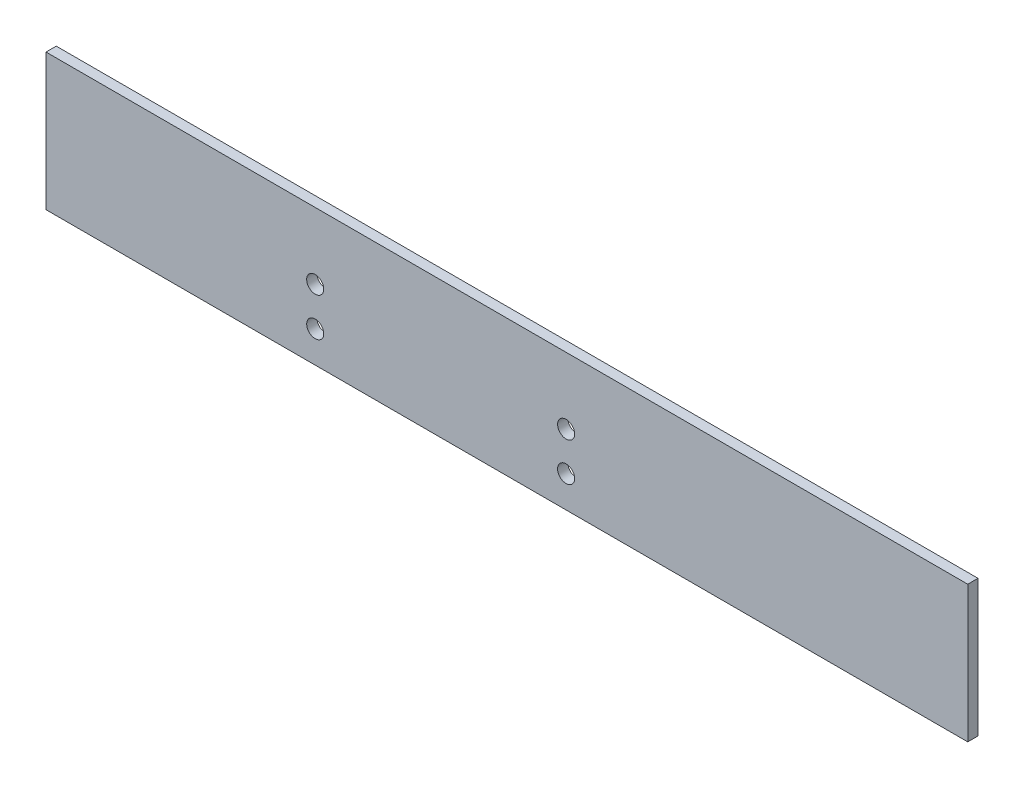
from build123d import *

# Parameters (mm, degrees)
ESQUISSE1_W        = 270
ESQUISSE1_H        = 40
ESQUISSE1_R        = 2.5
BOSS_EXTRU_1_DEPTH = 3


with BuildPart() as part:
    # Esquisse1 → Boss.-Extru.1 (new body)
    with BuildSketch(Plane.XY):
        with Locations((135, -20)):
            Rectangle(ESQUISSE1_W, ESQUISSE1_H)
        with Locations((78.854560725, -19.5)):
            Circle(ESQUISSE1_R, mode=Mode.SUBTRACT)
        with Locations((78.854560725, -30.8)):
            Circle(ESQUISSE1_R, mode=Mode.SUBTRACT)
        with Locations((152.35332983, -19.5)):
            Circle(ESQUISSE1_R, mode=Mode.SUBTRACT)
        with Locations((152.35332983, -30.8)):
            Circle(ESQUISSE1_R, mode=Mode.SUBTRACT)
    extrude(amount=BOSS_EXTRU_1_DEPTH)


solid = part.part
